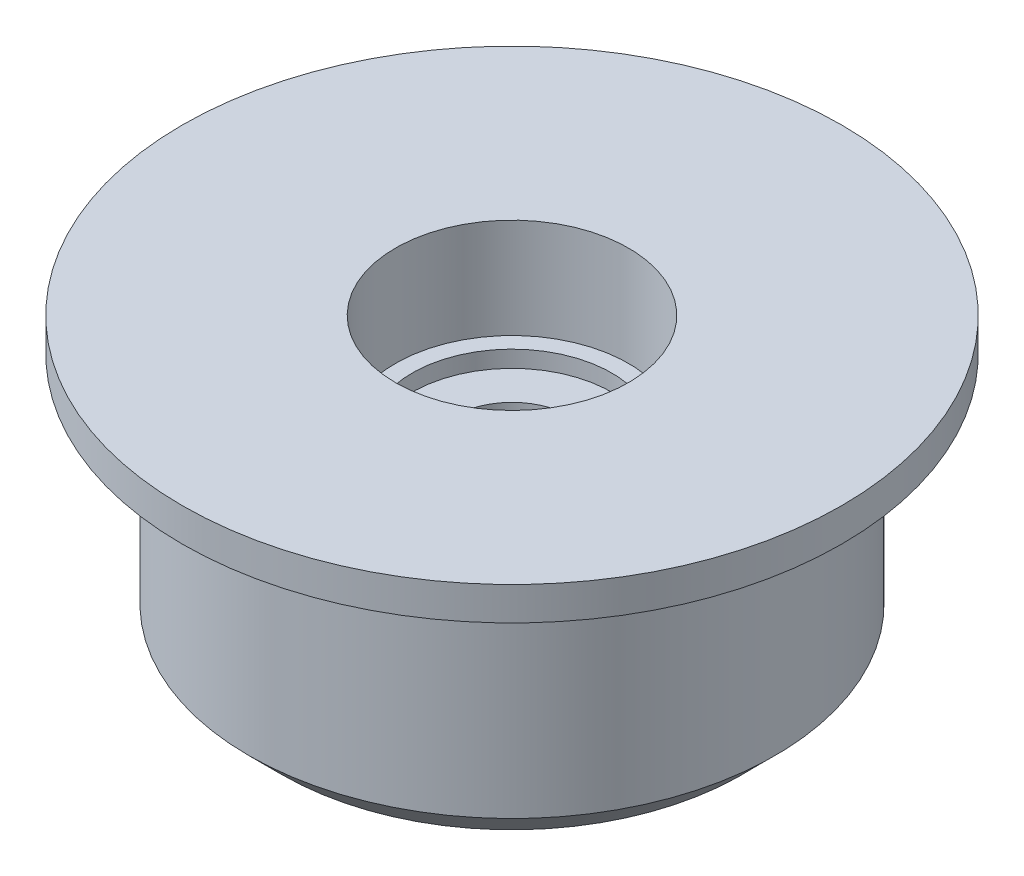
from build123d import *

# Parameters (mm, degrees)
CHAMFER1_SIZE = 1


with BuildPart() as part:
    # Sketch1 → Revolve1 (revolve)
    with BuildSketch(Plane.XY, mode=Mode.PRIVATE) as revolve1_sk:
        Polygon((1.75, 0), (7.9, 0), (7.9, 7.5), (9.9, 7.5), (9.9, 8.5), (3.5, 8.5), (3.5, 5.5), (3, 5.5), (3, 5), (1.75, 5), align=None)
    revolve(revolve1_sk.sketch.rotate(Axis((0, 37.275, 0), (0, -1, 0)), 90), axis=Axis((0, 37.275, 0), (0, -1, 0)))

    # Chamfer1
    chamfer1_edges = [part.edges().sort_by_distance(p)[0] for p in [
        (0, 0, -7.9),
    ]]
    chamfer(chamfer1_edges, length=CHAMFER1_SIZE)


solid = part.part
